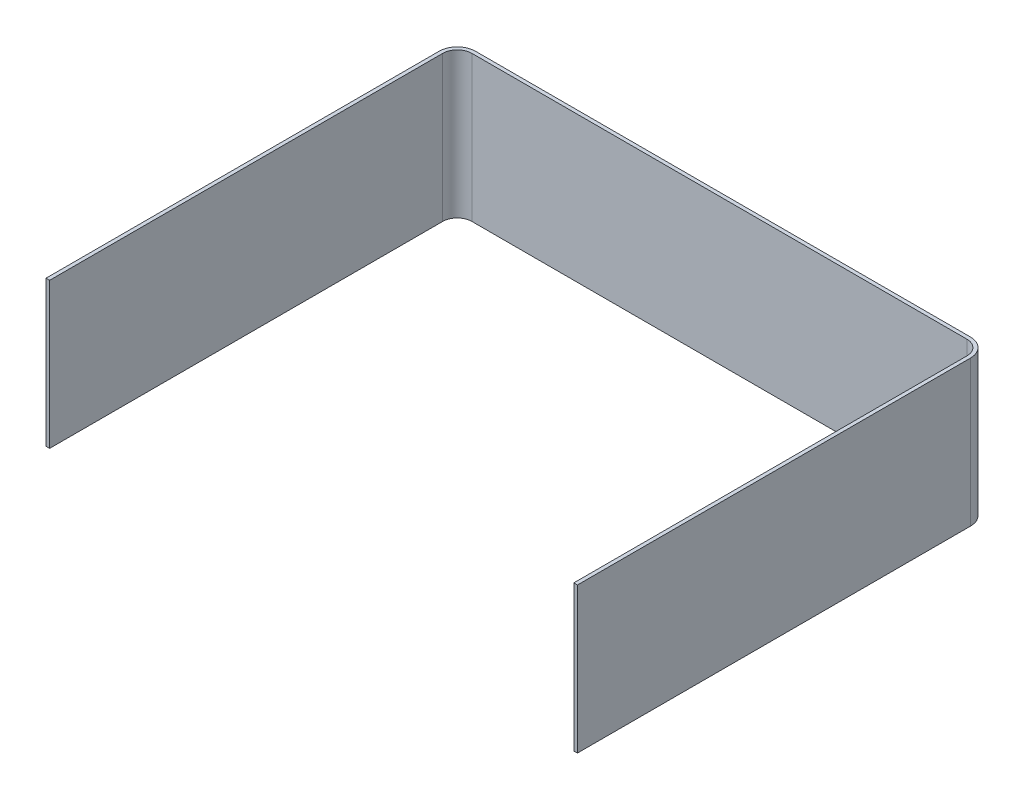
from build123d import *

# Parameters (mm, degrees)
BOSS_EXTRUDE1_DEPTH = 127


with BuildPart() as part:
    # Sketch1 → Boss-Extrude1 (new body)
    with BuildSketch(Plane(origin=(0, 0, 0), x_dir=(1, 0, 0), z_dir=(0, 1, 0))):
        with BuildLine():
            Line((-231.775, 165.1), (-231.775, -177.8))
            Line((-231.775, -177.8), (-228.6, -177.8))
            Line((-228.6, -177.8), (-228.6, 165.1))
            ThreePointArc((-228.6, 165.1), (-224.880256121, 174.080256121), (-215.9, 177.8))
            Line((-215.9, 177.8), (215.9, 177.8))
            ThreePointArc((215.9, 177.8), (224.880256121, 174.080256121), (228.6, 165.1))
            Line((228.6, 165.1), (228.6, -177.8))
            Line((228.6, -177.8), (231.775, -177.8))
            Line((231.775, -177.8), (231.775, 165.1))
            ThreePointArc((231.775, 165.1), (227.125320151, 176.325320151), (215.9, 180.975))
            Line((215.9, 180.975), (-215.9, 180.975))
            ThreePointArc((-215.9, 180.975), (-227.125320151, 176.325320151), (-231.775, 165.1))
        make_face()
    extrude(amount=BOSS_EXTRUDE1_DEPTH)


solid = part.part
